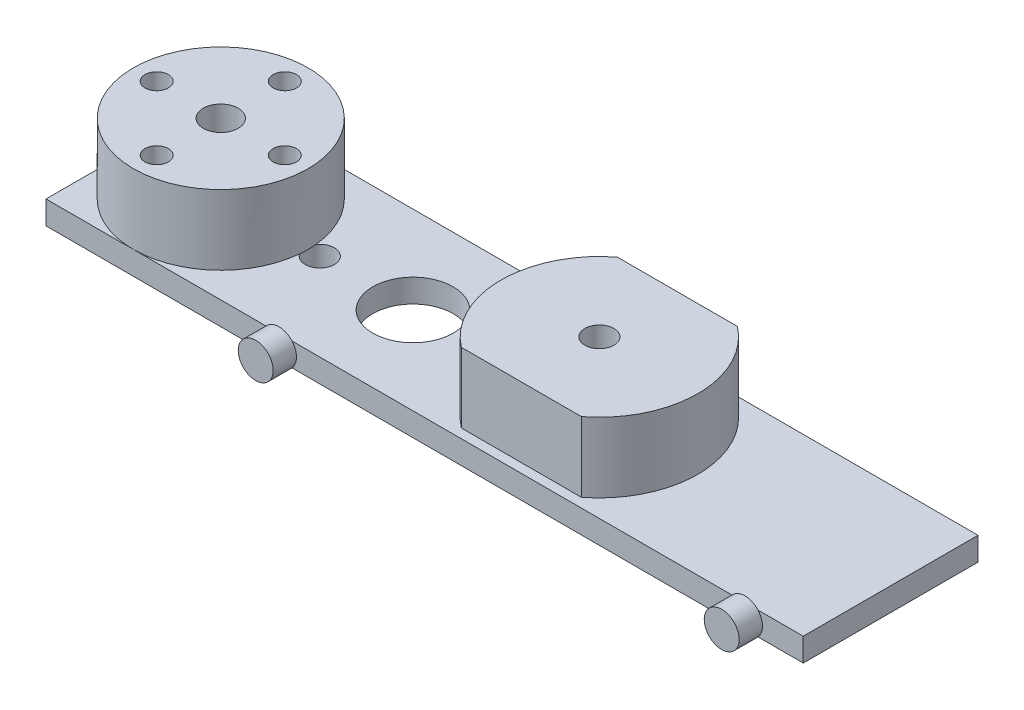
from build123d import *

# Parameters (mm, degrees)
SKETCH_1_W               = 65
SKETCH_1_H               = 15
EXTRUDE_1_DEPTH          = 2
SKETCH_2_R               = 1.25
SKETCH_2_R_2             = 3.45
SKETCH_2_R_3             = 1.5
SKETCH_2_R_4             = 1
CUT_EXTRUDE_1_DEPTH      = 2
SKETCH_4_R               = 1.5
EXTRUDE_2_DEPTH          = 2
SKETCH_5_R               = 7.5
SKETCH_5_R_2             = 7.2
EXTRUDE_3_DEPTH          = 6
SKETCH_5_8_R             = 1.25
SKETCH_5_8_R_2           = 7.2
EXTRUDE_4_DEPTH          = 6
CUT_EXTRUDE_2_DEPTH      = 3.5
CUT_EXTRUDE_2_DEPTH_BACK = 42.548164821
SKETCH_5_11_R            = 1.25
SKETCH_5_11_R_2          = 7.2
SKETCH_2_3_R             = 1.5
SKETCH_2_3_R_2           = 1
CUT_EXTRUDE_3_DEPTH      = 8


with BuildPart() as part:
    # 草图1 → 凸台-拉伸1 (new body)
    with BuildSketch(Plane(origin=(0, 0, 0), x_dir=(1, 0, 0), z_dir=(0, 1, 0))):
        with Locations((-7.5, 0)):
            Rectangle(SKETCH_1_W, SKETCH_1_H)
    extrude(amount=EXTRUDE_1_DEPTH)

    # 草图2 → 切除-拉伸1 (cut)
    with BuildSketch(Plane(origin=(0, 0, 0), x_dir=(1, 0, 0), z_dir=(0, 1, 0))):
        with Locations(Location((0, 0, 0), (0, 0, 270))):
            Circle(SKETCH_2_R)
        with Locations(Location((-16, 0, 0), (0, 0, 90))):
            Circle(SKETCH_2_R_2)
        with Locations(Location((-24, 0, 0), (0, 0, 90))):
            Circle(SKETCH_2_R)
        with Locations(Location((-32.5, 0, 0), (0, 0, 270))):
            Circle(SKETCH_2_R_3)
        with Locations(Location((-27, 0, 0), (0, 0, 270))):
            Circle(SKETCH_2_R_4)
        with Locations(Location((-32.5, -5.5, 0), (0, 0, 270))):
            Circle(SKETCH_2_R_4)
        with Locations(Location((-38, 0, 0), (0, 0, 270))):
            Circle(SKETCH_2_R_4)
        with Locations(Location((-32.5, 5.5, 0), (0, 0, 270))):
            Circle(SKETCH_2_R_4)
    extrude(amount=CUT_EXTRUDE_1_DEPTH, mode=Mode.SUBTRACT)

    # 草图4 → 凸台-拉伸2 (add)
    with BuildSketch(Plane.XY.offset(7.5)):
        with Locations(Location((20, 1, 0), (0, 0, 221.810314896))):
            Circle(SKETCH_4_R)
        with Locations(Location((-20, 1, 0), (0, 0, 221.810314896))):
            Circle(SKETCH_4_R)
    extrude(amount=EXTRUDE_2_DEPTH)

    # 草图5 → 凸台-拉伸3 (add)
    # profile 1 of 2: a face of its own
    with BuildSketch(Plane(origin=(0, 2, 0), x_dir=(1, 0, 0), z_dir=(0, 1, 0))):
        with Locations(Location((-32.5, 0, 0), (0, 0, 270))):
            Circle(SKETCH_5_R)
        with Locations(Location((-32.5, 0, 0), (0, 0, 270))):
            Circle(SKETCH_5_R_2, mode=Mode.SUBTRACT)
    # profile 2 of 2: a face of its own
    with BuildSketch(Plane(origin=(0, 2, 0), x_dir=(1, 0, 0), z_dir=(0, 1, 0))):
        with BuildLine():
            Line((5.149029035, -6.7), (-5.149029035, -6.7))
            ThreePointArc((-5.149029035, -6.7), (-8.45, 0), (-5.149029035, 6.7))
            Line((-5.149029035, 6.7), (5.149029035, 6.7))
            ThreePointArc((5.149029035, 6.7), (8.45, 0), (5.149029035, -6.7))
        make_face()
        with BuildLine():
            Line((4.905354218, -6), (-4.905354218, -6))
            ThreePointArc((-4.905354218, -6), (-7.75, 0), (-4.905354218, 6))
            Line((-4.905354218, 6), (4.905354218, 6))
            ThreePointArc((4.905354218, 6), (7.75, 0), (4.905354218, -6))
        make_face(mode=Mode.SUBTRACT)
    extrude(amount=EXTRUDE_3_DEPTH)

    # 草图5<8> → 凸台-拉伸4 (add)
    # profile 1 of 2: a face of its own
    with BuildSketch(Plane(origin=(0, 2, 0), x_dir=(1, 0, 0), z_dir=(0, 1, 0))):
        with BuildLine():
            Line((4.905354218, -6), (-4.905354218, -6))
            ThreePointArc((-4.905354218, -6), (-7.75, 0), (-4.905354218, 6))
            Line((-4.905354218, 6), (4.905354218, 6))
            ThreePointArc((4.905354218, 6), (7.75, 0), (4.905354218, -6))
        make_face()
        with Locations(Location((0, 0, 0), (0, 0, 270))):
            Circle(SKETCH_5_8_R, mode=Mode.SUBTRACT)
    # profile 2 of 2: a face of its own
    with BuildSketch(Plane(origin=(0, 2, 0), x_dir=(1, 0, 0), z_dir=(0, 1, 0))):
        with Locations((-32.5, 0)):
            Circle(SKETCH_5_8_R_2)
    extrude(amount=EXTRUDE_4_DEPTH)

    # 草图5<11> → 切除-拉伸2 (cut, two sides: drawn at the far end of the back side and taken through both)
    # profile 1 of 2: a face of its own
    with BuildSketch(Plane(origin=(0, 2, 0), x_dir=(1, 0, 0), z_dir=(0, 1, 0)).offset(-CUT_EXTRUDE_2_DEPTH_BACK)):
        with BuildLine():
            Line((4.905354218, -6), (-4.905354218, -6))
            ThreePointArc((-4.905354218, -6), (-7.75, 0), (-4.905354218, 6))
            Line((-4.905354218, 6), (4.905354218, 6))
            ThreePointArc((4.905354218, 6), (7.75, 0), (4.905354218, -6))
        make_face()
        with Locations(Location((0, 0, 0), (0, 0, 270))):
            Circle(SKETCH_5_11_R, mode=Mode.SUBTRACT)
    # profile 2 of 2: a face of its own
    with BuildSketch(Plane(origin=(0, 2, 0), x_dir=(1, 0, 0), z_dir=(0, 1, 0)).offset(-CUT_EXTRUDE_2_DEPTH_BACK)):
        with Locations(Location((-32.5, 0, 0), (0, 0, 270))):
            Circle(SKETCH_5_11_R_2)
    extrude(amount=CUT_EXTRUDE_2_DEPTH + CUT_EXTRUDE_2_DEPTH_BACK, mode=Mode.SUBTRACT)

    # 草图2<3> → 切除-拉伸3 (cut)
    with BuildSketch(Plane(origin=(0, 0, 0), x_dir=(1, 0, 0), z_dir=(0, 1, 0))):
        with Locations(Location((-32.5, 0, 0), (0, 0, 270))):
            Circle(SKETCH_2_3_R)
        with Locations(Location((-32.5, 5.5, 0), (0, 0, 270))):
            Circle(SKETCH_2_3_R_2)
        with Locations(Location((-38, 0, 0), (0, 0, 270))):
            Circle(SKETCH_2_3_R_2)
        with Locations(Location((-32.5, -5.5, 0), (0, 0, 270))):
            Circle(SKETCH_2_3_R_2)
        with Locations(Location((-27, 0, 0), (0, 0, 270))):
            Circle(SKETCH_2_3_R_2)
    extrude(amount=CUT_EXTRUDE_3_DEPTH, mode=Mode.SUBTRACT)


solid = part.part
